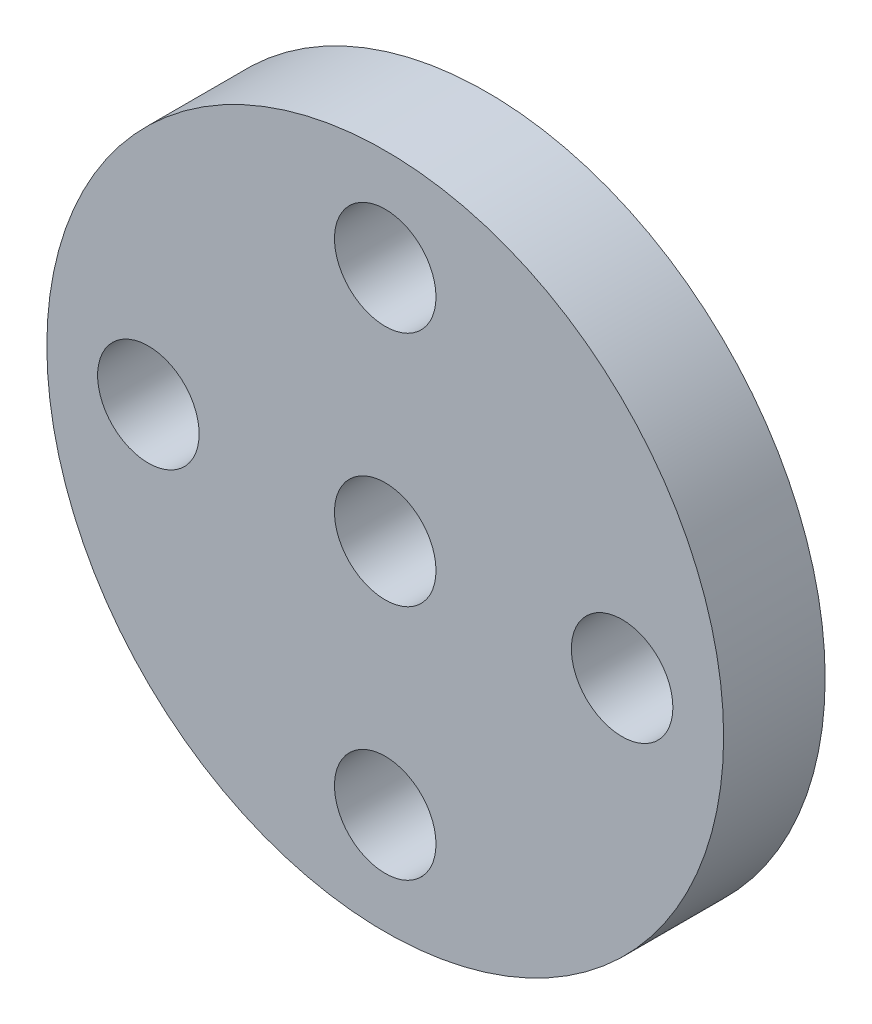
from build123d import *

# Parameters (mm, degrees)
SKETCH_1_R      = 10
SKETCH_1_R_2    = 1.5
EXTRUDE_1_DEPTH = 3


with BuildPart() as part:
    # Эскиз1 → Бобышка-Вытянуть1 (new body)
    with BuildSketch(Plane.XY):
        Circle(SKETCH_1_R)
        with Locations((0, 7)):
            Circle(SKETCH_1_R_2, mode=Mode.SUBTRACT)
        with Locations((7, 0)):
            Circle(SKETCH_1_R_2, mode=Mode.SUBTRACT)
        with Locations((0, -7)):
            Circle(SKETCH_1_R_2, mode=Mode.SUBTRACT)
        with Locations((-7, 0)):
            Circle(SKETCH_1_R_2, mode=Mode.SUBTRACT)
        Circle(SKETCH_1_R_2, mode=Mode.SUBTRACT)
    extrude(amount=EXTRUDE_1_DEPTH)


solid = part.part
